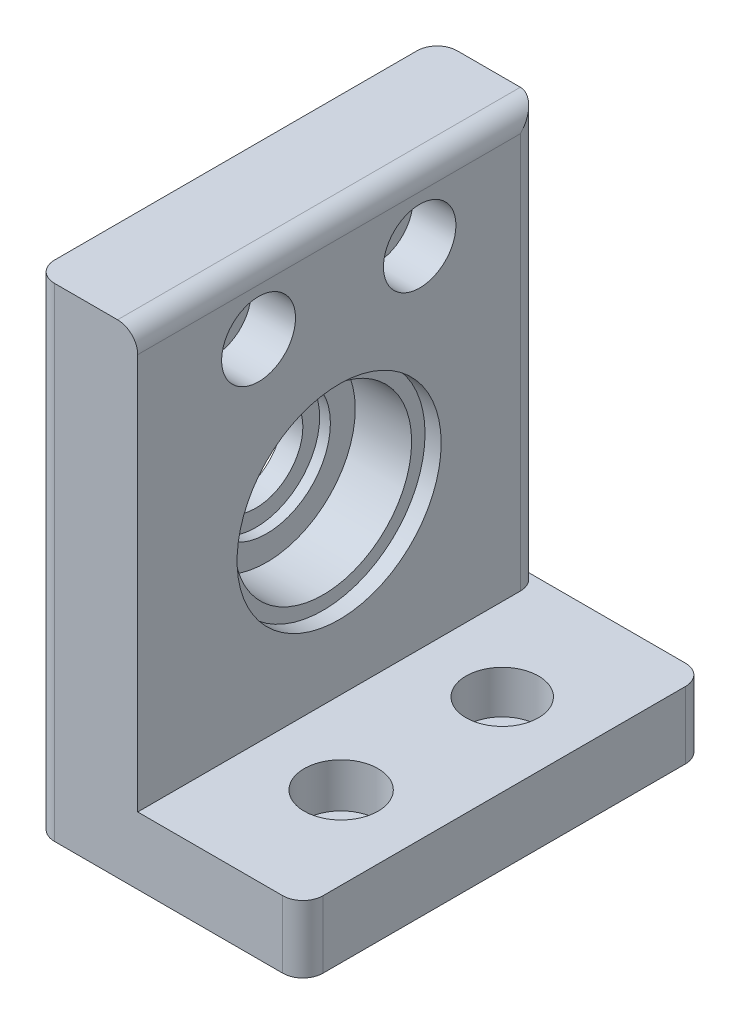
from build123d import *

# Parameters (mm, degrees)
SKETCH1_W               = 20
SKETCH1_H               = 30
BOSS_EXTRUDE1_DEPTH     = 5
SKETCH2_W               = 7.7
SKETCH2_H               = 30
BOSS_EXTRUDE2_DEPTH     = 25
CUT_EXTRUDE1_DEPTH      = 36.725201189
CUT_EXTRUDE1_DEPTH_BACK = 36.725201189
SKETCH3_R               = 3.5
SKETCH4_R               = 7.6
CUT_EXTRUDE2_DEPTH      = 1.2
SKETCH5_R               = 6.6
CUT_EXTRUDE3_DEPTH      = 4.2
SKETCH6_R               = 4.75
CUT_EXTRUDE4_DEPTH      = 0.8
CUT_EXTRUDE5_DEPTH      = 31.822070015
CUT_EXTRUDE5_DEPTH_BACK = 31.822070015
SKETCH7_R               = 1.65
SKETCH7_R_2             = 1.7
SKETCH8_R               = 2.7
CUT_EXTRUDE6_DEPTH      = 3.2
SKETCH9_R               = 2.75
CUT_EXTRUDE7_DEPTH      = 3.3
SKETCH10_W              = 7.7
SKETCH10_H              = 30
BOSS_EXTRUDE3_DEPTH     = 6
CUT_EXTRUDE8_DEPTH      = 41.893642538
CUT_EXTRUDE8_DEPTH_BACK = 41.893642538
SKETCH11_R              = 1.7
SKETCH11_R_2            = 1.65
SKETCH12_R              = 2.7
CUT_EXTRUDE9_DEPTH      = 3.2
SKETCH13_R              = 2.75
CUT_EXTRUDE10_DEPTH     = 3.3
SKETCH14_R              = 1.5
CUT_EXTRUDE11_DEPTH     = 4.5
CHAMFER1_SIZE           = 0.75
FILLET1_R               = 1.5


with BuildPart() as part:
    # Sketch1 → Boss-Extrude1 (new body)
    with BuildSketch(Plane(origin=(0, 0, 0), x_dir=(1, 0, 0), z_dir=(0, 1, 0))):
        Rectangle(SKETCH1_W, SKETCH1_H)
    extrude(amount=BOSS_EXTRUDE1_DEPTH)

    # Sketch2 → Boss-Extrude2 (add)
    with BuildSketch(Plane(origin=(0, 5, 0), x_dir=(1, 0, 0), z_dir=(0, 1, 0))):
        with Locations((-6.15, 0)):
            Rectangle(SKETCH2_W, SKETCH2_H)
    extrude(amount=BOSS_EXTRUDE2_DEPTH)

    # Sketch3 → Cut-Extrude1 (cut, two sides: drawn at the far end of the back side and taken through both)
    with BuildSketch(Plane(origin=(-2.3, 0, 0), x_dir=(0, 0, -1), z_dir=(1, 0, 0)).offset(-CUT_EXTRUDE1_DEPTH_BACK)):
        with Locations((0, 17.5)):
            Circle(SKETCH3_R)
    extrude(amount=CUT_EXTRUDE1_DEPTH + CUT_EXTRUDE1_DEPTH_BACK, mode=Mode.SUBTRACT)

    # Sketch4 → Cut-Extrude2 (cut)
    with BuildSketch(Plane(origin=(-2.3, 0, 0), x_dir=(0, 0, -1), z_dir=(1, 0, 0))):
        with Locations((0, 17.5)):
            Circle(SKETCH4_R)
    extrude(amount=-CUT_EXTRUDE2_DEPTH, mode=Mode.SUBTRACT)

    # Sketch5 → Cut-Extrude3 (cut)
    with BuildSketch(Plane(origin=(-3.5, 0, 0), x_dir=(0, 0, -1), z_dir=(1, 0, 0))):
        with Locations((0, 17.5)):
            Circle(SKETCH5_R)
    extrude(amount=-CUT_EXTRUDE3_DEPTH, mode=Mode.SUBTRACT)

    # Sketch6 → Cut-Extrude4 (cut)
    with BuildSketch(Plane(origin=(-7.7, 0, 0), x_dir=(0, 0, -1), z_dir=(1, 0, 0))):
        with Locations((0, 17.5)):
            Circle(SKETCH6_R)
    extrude(amount=-CUT_EXTRUDE4_DEPTH, mode=Mode.SUBTRACT)

    # Sketch7 → Cut-Extrude5 (cut, two sides: drawn at the far end of the back side and taken through both)
    with BuildSketch(Plane(origin=(0, 5, 0), x_dir=(1, 0, 0), z_dir=(0, 1, 0)).offset(-CUT_EXTRUDE5_DEPTH_BACK)):
        with Locations(Location((3.85, 6, 0), (0, 0, 270))):
            Circle(SKETCH7_R)
        with Locations(Location((3.85, -6, 0), (0, 0, 270))):
            Circle(SKETCH7_R_2)
    extrude(amount=CUT_EXTRUDE5_DEPTH + CUT_EXTRUDE5_DEPTH_BACK, mode=Mode.SUBTRACT)

    # Sketch8 → Cut-Extrude6 (cut)
    with BuildSketch(Plane(origin=(0, 5, 0), x_dir=(1, 0, 0), z_dir=(0, 1, 0))):
        with Locations(Location((3.85, 6, 0), (0, 0, 270))):
            Circle(SKETCH8_R)
    extrude(amount=-CUT_EXTRUDE6_DEPTH, mode=Mode.SUBTRACT)

    # Sketch9 → Cut-Extrude7 (cut)
    with BuildSketch(Plane(origin=(0, 5, 0), x_dir=(1, 0, 0), z_dir=(0, 1, 0))):
        with Locations(Location((3.85, -6, 0), (0, 0, 270))):
            Circle(SKETCH9_R)
    extrude(amount=-CUT_EXTRUDE7_DEPTH, mode=Mode.SUBTRACT)

    # Sketch10 → Boss-Extrude3 (add)
    with BuildSketch(Plane(origin=(0, 30, 0), x_dir=(1, 0, 0), z_dir=(0, 1, 0))):
        with Locations((-6.15, 0)):
            Rectangle(SKETCH10_W, SKETCH10_H)
    extrude(amount=BOSS_EXTRUDE3_DEPTH)

    # Sketch11 → Cut-Extrude8 (cut, two sides: drawn at the far end of the back side and taken through both)
    with BuildSketch(Plane(origin=(-2.3, 0, 0), x_dir=(0, 0, -1), z_dir=(1, 0, 0)).offset(-CUT_EXTRUDE8_DEPTH_BACK)):
        with Locations((-6, 31)):
            Circle(SKETCH11_R)
        with Locations((6, 31)):
            Circle(SKETCH11_R_2)
    extrude(amount=CUT_EXTRUDE8_DEPTH + CUT_EXTRUDE8_DEPTH_BACK, mode=Mode.SUBTRACT)

    # Sketch12 → Cut-Extrude9 (cut)
    with BuildSketch(Plane(origin=(-2.3, 0, 0), x_dir=(0, 0, -1), z_dir=(1, 0, 0))):
        with Locations((6, 31)):
            Circle(SKETCH12_R)
    extrude(amount=-CUT_EXTRUDE9_DEPTH, mode=Mode.SUBTRACT)

    # Sketch13 → Cut-Extrude10 (cut)
    with BuildSketch(Plane(origin=(-2.3, 0, 0), x_dir=(0, 0, -1), z_dir=(1, 0, 0))):
        with Locations((-6, 31)):
            Circle(SKETCH13_R)
    extrude(amount=-CUT_EXTRUDE10_DEPTH, mode=Mode.SUBTRACT)

    # Sketch14 → Cut-Extrude11 (cut)
    with BuildSketch(Plane.ZY.offset(10)):
        with Locations((-9.525, 17.5)):
            Circle(SKETCH14_R)
        with Locations((9.525, 17.5)):
            Circle(SKETCH14_R)
    extrude(amount=-CUT_EXTRUDE11_DEPTH, mode=Mode.SUBTRACT)

    # Chamfer1
    chamfer1_edges = [part.edges().sort_by_distance(p)[0] for p in [
        (-10, 17.5, -11.025),
        (-10, 17.5, 8.025),
    ]]
    chamfer(chamfer1_edges, length=CHAMFER1_SIZE)

    # Fillet1
    fillet1_edges = [part.edges().sort_by_distance(p)[0] for p in [
        (-2.3, 20.5, -15),
        (10, 2.5, 15),
        (-10, 18, 15),
        (-10, 18, -15),
        (-2.3, 36, 0),
        (10, 2.5, -15),
    ]]
    fillet(fillet1_edges, radius=FILLET1_R)


solid = part.part
